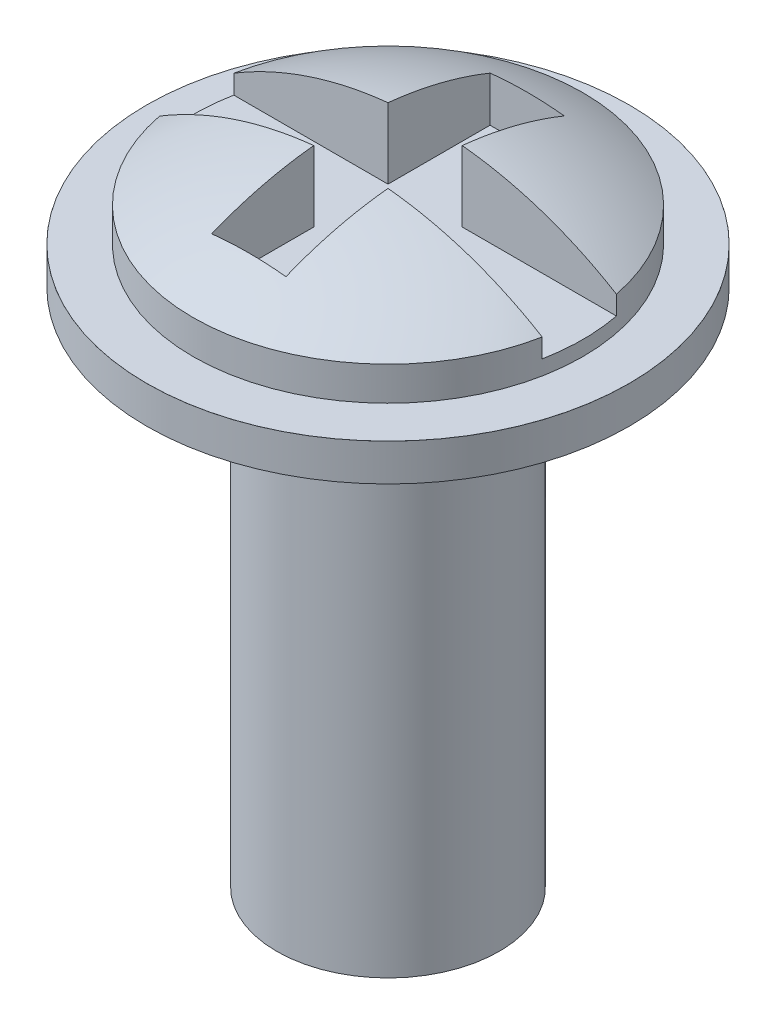
from build123d import *

# Parameters (mm, degrees)
SKETCH_1_R          = 1.5
EXTRUDE_1_DEPTH     = 7
SKETCH_6_R          = 3.25
EXTRUDE_1_2_DEPTH   = 0.5
SKETCH_2_R          = 2.625
EXTRUDE_2_DEPTH     = 1.2
SKETCH_3_W          = 7.004697232
SKETCH_3_H          = 1
CUT_EXTRUDE_1_DEPTH = 1
SKETCH_4_W          = 1
SKETCH_4_H          = 3.75
CUT_EXTRUDE_2_DEPTH = 1


with BuildPart() as part:
    # 草图1 → Extrude 1 (new body)
    with BuildSketch(Plane(origin=(0, 0, 0), x_dir=(1, 0, 0), z_dir=(0, 1, 0))):
        with Locations(Location((0, 0, 0), (0, 0, 270))):
            Circle(SKETCH_1_R)
    extrude(amount=EXTRUDE_1_DEPTH)

    # 草图6 → Extrude 1 2 (add)
    with BuildSketch(Plane(origin=(0, 7, 0), x_dir=(1, 0, 0), z_dir=(0, 1, 0))):
        with Locations(Location((0, 0, 0), (0, 0, 270))):
            Circle(SKETCH_6_R)
    extrude(amount=EXTRUDE_1_2_DEPTH)

    # 草图2 → 拉伸2 (add)
    with BuildSketch(Plane(origin=(0, 7.5, 0), x_dir=(-1, 0, 0), z_dir=(0, 1, 0))):
        with Locations(Location((0, 0, 0), (0, 0, 90))):
            Circle(SKETCH_2_R)
    extrude(amount=EXTRUDE_2_DEPTH)

    # 草图3 → 切除-拉伸1 (cut)
    with BuildSketch(Plane(origin=(0, 8.7, 0), x_dir=(-1, 0, 0), z_dir=(0, 1, 0))):
        Rectangle(SKETCH_3_W, SKETCH_3_H)
    extrude(amount=-CUT_EXTRUDE_1_DEPTH, mode=Mode.SUBTRACT)

    # 草图4 → 切除-拉伸2 (cut)
    with BuildSketch(Plane(origin=(0, 8.7, 0), x_dir=(-1, 0, 0), z_dir=(0, 1, 0))):
        Rectangle(SKETCH_4_W, SKETCH_4_H)
    extrude(amount=-CUT_EXTRUDE_2_DEPTH, mode=Mode.SUBTRACT)

    # 草图5 → 切除-旋转16 (revolve, cut)
    with BuildSketch(Plane(origin=(0, 0, 0), x_dir=(0, 0, -1), z_dir=(1, 0, 0))):
        with BuildLine():
            Line((0, 11.324107024), (-3.685811759, 11.324107024))
            Line((-3.685811759, 11.324107024), (-3.685811759, 7.078578352))
            ThreePointArc((-3.685811759, 7.078578352), (-2.013344014, 8.276728731), (0, 8.7))
            Line((0, 8.7), (0, 11.324107024))
        make_face()
    revolve(axis=Axis((0, -2.105917543, 0), (0, 1, 0)), mode=Mode.SUBTRACT)


solid = part.part
